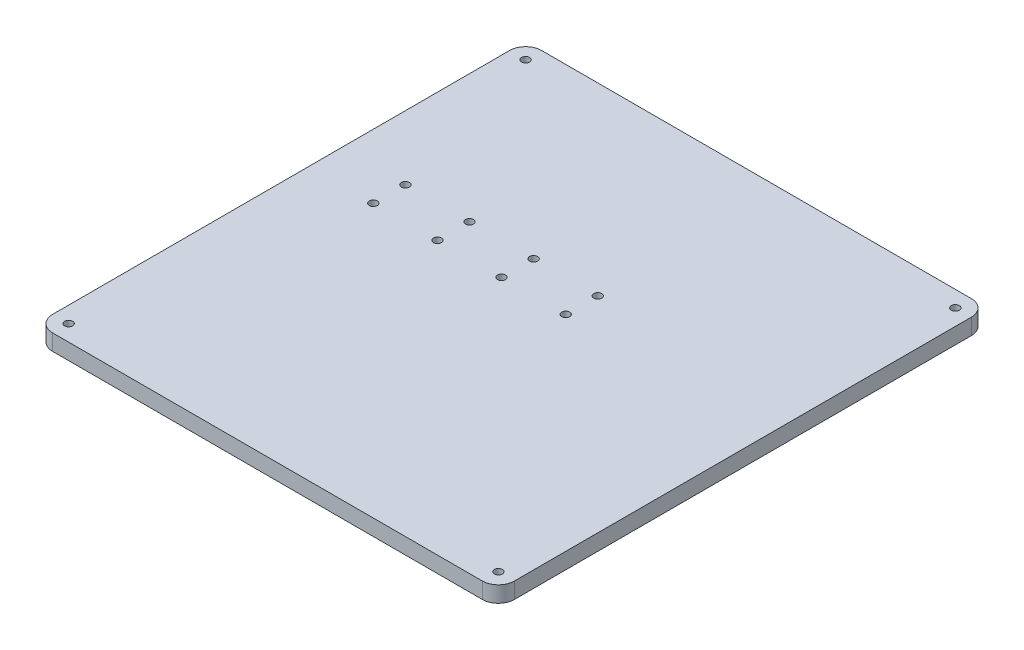
from build123d import *

# Parameters (mm, degrees)
SKETCH1_W           = 288
SKETCH1_H           = 305
SKETCH1_R           = 2.5
BOSS_EXTRUDE1_DEPTH = 10
FILLET1_R           = 10


with BuildPart() as part:
    # Sketch1 → Boss-Extrude1 (new body)
    with BuildSketch(Plane(origin=(0, 0, 0), x_dir=(1, 0, 0), z_dir=(0, 1, 0))):
        with Locations((45.382488479, -91.233870968)):
            Rectangle(SKETCH1_W, SKETCH1_H)
        with Locations(Location((-58.617511521, -53.733870968, 0), (0, 0, 270))):
            Circle(SKETCH1_R, mode=Mode.SUBTRACT)
        with Locations(Location((-18.617511521, -53.733870968, 0), (0, 0, 270))):
            Circle(SKETCH1_R, mode=Mode.SUBTRACT)
        with Locations(Location((21.382488479, -53.733870968, 0), (0, 0, 270))):
            Circle(SKETCH1_R, mode=Mode.SUBTRACT)
        with Locations(Location((61.382488479, -53.733870968, 0), (0, 0, 270))):
            Circle(SKETCH1_R, mode=Mode.SUBTRACT)
        with Locations(Location((-18.617511521, -73.733870968, 0), (0, 0, 270))):
            Circle(SKETCH1_R, mode=Mode.SUBTRACT)
        with Locations(Location((21.382488479, -73.733870968, 0), (0, 0, 270))):
            Circle(SKETCH1_R, mode=Mode.SUBTRACT)
        with Locations(Location((61.382488479, -73.733870968, 0), (0, 0, 270))):
            Circle(SKETCH1_R, mode=Mode.SUBTRACT)
        with Locations(Location((-58.617511521, -73.733870968, 0), (0, 0, 270))):
            Circle(SKETCH1_R, mode=Mode.SUBTRACT)
        with Locations(Location((-88.617511521, 51.266129032, 0), (0, 0, 270))):
            Circle(SKETCH1_R, mode=Mode.SUBTRACT)
        with Locations(Location((179.382488479, 51.266129032, 0), (0, 0, 90))):
            Circle(SKETCH1_R, mode=Mode.SUBTRACT)
        with Locations(Location((179.382488479, -233.733870968, 0), (0, 0, 270))):
            Circle(SKETCH1_R, mode=Mode.SUBTRACT)
        with Locations(Location((-88.617511521, -233.733870968, 0), (0, 0, 90))):
            Circle(SKETCH1_R, mode=Mode.SUBTRACT)
    extrude(amount=BOSS_EXTRUDE1_DEPTH)

    # Fillet1
    fillet1_edges = [part.edges().sort_by_distance(p)[0] for p in [
        (-98.617511521, 5, -61.266129032),
        (189.382488479, 5, -61.266129032),
        (189.382488479, 5, 243.733870968),
        (-98.617511521, 5, 243.733870968),
    ]]
    fillet(fillet1_edges, radius=FILLET1_R)


solid = part.part
